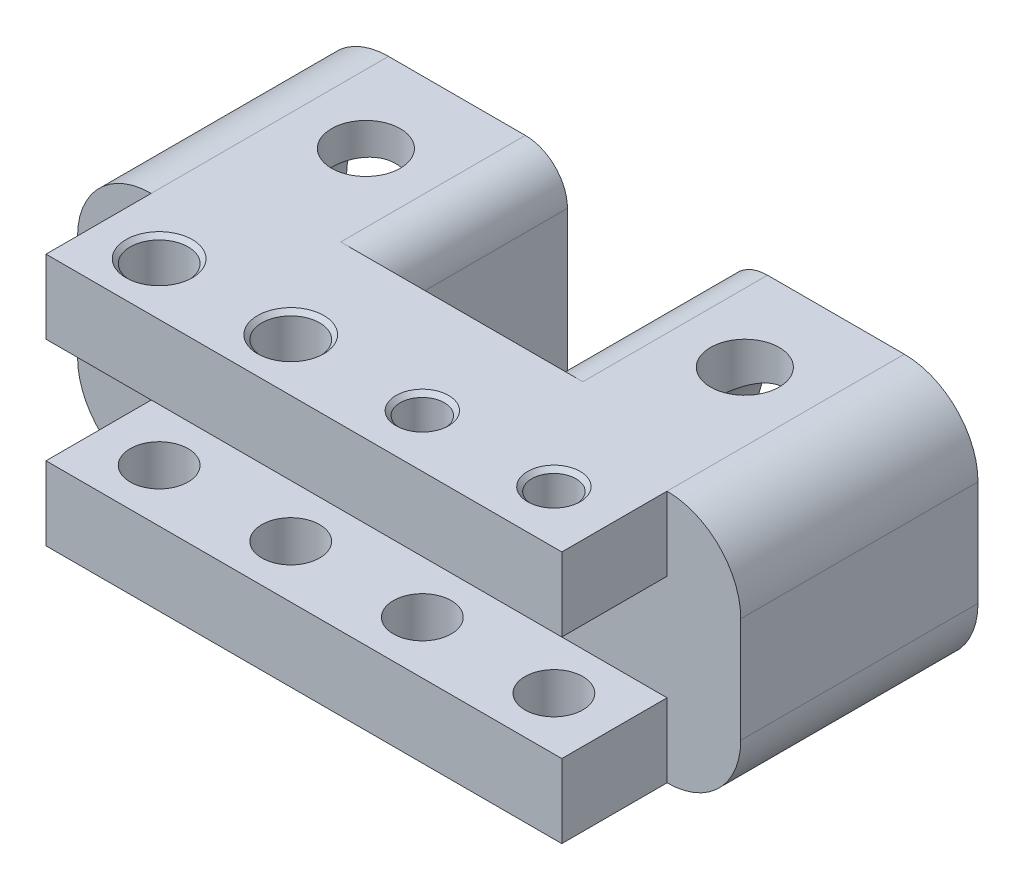
from build123d import *

# Parameters (mm, degrees)
SKETCH1_W                  = 63
SKETCH1_H                  = 24
BOSS_EXTRUDE1_DEPTH        = 20
SKETCH2_W                  = 15
SKETCH2_H                  = 15
CUT_EXTRUDE1_DEPTH         = 59.326666286
SKETCH3_W                  = 49
SKETCH3_H                  = 7
BOSS_EXTRUDE2_DEPTH        = 10
SKETCH4_W                  = 49
SKETCH4_H                  = 7
BOSS_EXTRUDE3_DEPTH        = 10
HOLE1_D                    = 18
HOLE1_DEPTH                = 15
F_6_CLEARANCE_HOLE1_D      = 4.2
F_6_CLEARANCE_HOLE1_DEPTH  = 7
F_6_CLEARANCE_HOLE2_D      = 4.2
F_6_CLEARANCE_HOLE2_DEPTH  = 7
F_10_CLEARANCE_HOLE1_D     = 5.5
F_10_CLEARANCE_HOLE1_DEPTH = 24
F_10_CLEARANCE_HOLE2_D     = 5.5
F_10_CLEARANCE_HOLE2_DEPTH = 7
CHAMFER1_SIZE              = 0.4
FILLET1_R                  = 4
FILLET2_R                  = 7
BOSS_EXTRUDE5_START        = 2.54
SKETCH20_R                 = 9
BOSS_EXTRUDE5_DEPTH        = 2.54
SKETCH21_R                 = 3.2639
CUT_EXTRUDE4_DEPTH         = 60.030937651


with BuildPart() as part:
    # Sketch1 → Boss-Extrude1 (new body)
    with BuildSketch(Plane.XY.offset(5)):
        with Locations((19.5, 0)):
            Rectangle(SKETCH1_W, SKETCH1_H)
    extrude(amount=-BOSS_EXTRUDE1_DEPTH)

    # Sketch2 → Cut-Extrude1 (cut, through all)
    with BuildSketch(Plane.XZ.offset(12)):
        with Locations((19.5, -7.5)):
            Rectangle(SKETCH2_W, SKETCH2_H)
    extrude(amount=-CUT_EXTRUDE1_DEPTH, mode=Mode.SUBTRACT)

    # Sketch3 → Boss-Extrude2 (add)
    with BuildSketch(Plane.XY.offset(5)):
        with Locations((19.5, -8.5)):
            Rectangle(SKETCH3_W, SKETCH3_H)
    extrude(amount=BOSS_EXTRUDE2_DEPTH)

    # Sketch4 → Boss-Extrude3 (add)
    with BuildSketch(Plane.XY.offset(5)):
        with Locations((19.5, 8.5)):
            Rectangle(SKETCH4_W, SKETCH4_H)
    extrude(amount=BOSS_EXTRUDE3_DEPTH)

    # Hole1
    with Locations(Plane(origin=(0, 0, -15), x_dir=(-1, 0, 0), z_dir=(0, 0, -1))):
        with Locations((0, 0), (-39, 0)):
            Hole(HOLE1_D / 2, depth=HOLE1_DEPTH)

    # #6 Clearance Hole1
    with Locations(Plane(origin=(0, 5, 0), x_dir=(-1, 0, 0), z_dir=(0, -1, 0))):
        with Locations((-0.75, -10)):
            Hole(F_6_CLEARANCE_HOLE1_D / 2, depth=F_6_CLEARANCE_HOLE1_DEPTH)

    # #6 Clearance Hole2
    with Locations(Plane(origin=(0, 12, 0), x_dir=(1, 0, 0), z_dir=(0, 1, 0))):
        with Locations((38.25, -10), (25.75, -10), (13.25, -10)):
            Hole(F_6_CLEARANCE_HOLE2_D / 2, depth=F_6_CLEARANCE_HOLE2_DEPTH)

    # #10 Clearance Hole1
    with Locations(Plane(origin=(0, -12, 0), x_dir=(-1, 0, 0), z_dir=(0, -1, 0))):
        with Locations((-13.25, -10), (-0.75, -10)):
            Hole(F_10_CLEARANCE_HOLE1_D / 2, depth=F_10_CLEARANCE_HOLE1_DEPTH)

    # #10 Clearance Hole2
    with Locations(Plane(origin=(0, -5, 0), x_dir=(1, 0, 0), z_dir=(0, 1, 0))):
        with Locations((38.25, -10), (25.75, -10)):
            Hole(F_10_CLEARANCE_HOLE2_D / 2, depth=F_10_CLEARANCE_HOLE2_DEPTH)

    # Chamfer1
    chamfer1_edges = [part.edges().sort_by_distance(p)[0] for p in [
        (10.5, 12, 10),
        (10.5, -12, 10),
        (28.5, -12, 10),
        (41, -12, 10),
        (27.85, 12, 10),
        (40.35, 12, 10),
        (-2, 12, 10),
        (-2, -12, 10),
    ]]
    chamfer(chamfer1_edges, length=CHAMFER1_SIZE)

    # Fillet1
    fillet1_edges = [part.edges().sort_by_distance(p)[0] for p in [
        (12, 12, -7.5),
        (27, 12, -7.5),
        (12, -12, -7.5),
        (27, -12, -7.5),
    ]]
    fillet(fillet1_edges, radius=FILLET1_R)

    # Fillet2
    fillet2_edges = [part.edges().sort_by_distance(p)[0] for p in [
        (51, -12, -5),
        (-12, 12, -5),
        (51, 12, -5),
        (-12, -12, -5),
    ]]
    fillet(fillet2_edges, radius=FILLET2_R)

    # Sketch20 → Boss-Extrude5 (add)
    # profile 1 of 2: a face of its own
    with BuildSketch(Plane(origin=(0, 0, -15), x_dir=(-1, 0, 0), z_dir=(0, 0, -1)).offset(BOSS_EXTRUDE5_START)):
        with BuildLine():
            Line((12, -5), (12, 5))
            ThreePointArc((12, 5), (9.949747468, 9.949747468), (5, 12))
            Line((5, 12), (-8, 12))
            ThreePointArc((-8, 12), (-10.828427125, 10.828427125), (-12, 8))
            Line((-12, 8), (-12, -8))
            ThreePointArc((-12, -8), (-10.828427125, -10.828427125), (-8, -12))
            Line((-8, -12), (5, -12))
            ThreePointArc((5, -12), (9.949747468, -9.949747468), (12, -5))
        make_face()
        Circle(SKETCH20_R, mode=Mode.SUBTRACT)
    # profile 2 of 2: a face of its own
    with BuildSketch(Plane(origin=(0, 0, -15), x_dir=(-1, 0, 0), z_dir=(0, 0, -1)).offset(BOSS_EXTRUDE5_START)):
        with BuildLine():
            Line((-51, 5), (-51, -5))
            ThreePointArc((-51, -5), (-48.949747468, -9.949747468), (-44, -12))
            Line((-44, -12), (-31, -12))
            ThreePointArc((-31, -12), (-28.171572875, -10.828427125), (-27, -8))
            Line((-27, -8), (-27, 8))
            ThreePointArc((-27, 8), (-28.171572875, 10.828427125), (-31, 12))
            Line((-31, 12), (-44, 12))
            ThreePointArc((-44, 12), (-48.949747468, 9.949747468), (-51, 5))
        make_face()
        with Locations((-39, 0)):
            Circle(SKETCH20_R, mode=Mode.SUBTRACT)
    extrude(amount=-BOSS_EXTRUDE5_DEPTH)

    # Sketch21 → Cut-Extrude4 (cut, through all)
    with BuildSketch(Plane(origin=(0, 12, 0), x_dir=(1, 0, 0), z_dir=(0, 1, 0))):
        with Locations(Location((37.5, 8.89, 0), (0, 0, 270))):
            Circle(SKETCH21_R)
        with Locations(Location((1.5, 8.89, 0), (0, 0, 270))):
            Circle(SKETCH21_R)
    extrude(amount=-CUT_EXTRUDE4_DEPTH, mode=Mode.SUBTRACT)


solid = part.part
